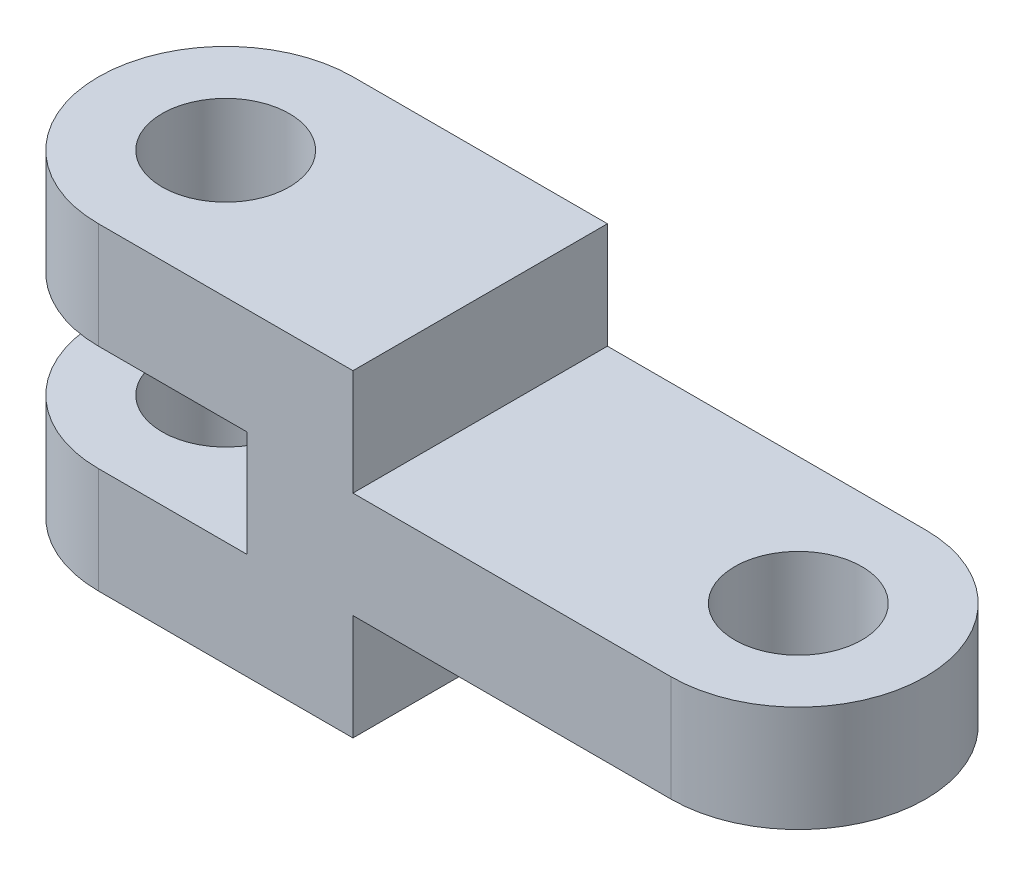
from build123d import *

# Parameters (mm, degrees)
BOSS_EXTRUDE1_DEPTH     = 60
BOSS_EXTRUDE2_DEPTH     = 25
BOSS_EXTRUDE3_DEPTH     = 25
BOSS_EXTRUDE4_DEPTH     = 25
CUT_EXTRUDE2_DEPTH      = 191.91883092
CUT_EXTRUDE2_DEPTH_BACK = 191.91883092
SKETCH6_R               = 15
CUT_EXTRUDE3_DEPTH      = 183.551362635
CUT_EXTRUDE3_DEPTH_BACK = 183.551362635
SKETCH7_R               = 15


with BuildPart() as part:
    # Sketch1 → Boss-Extrude1 (new body)
    with BuildSketch(Plane.XY):
        Polygon((0, 0), (60, 0), (60, -25), (135, -25), (135, -50), (60, -50), (60, -75), (0, -75), (0, -50), (35, -50), (35, -25), (0, -25), align=None)
    extrude(amount=BOSS_EXTRUDE1_DEPTH)

    # Sketch3 → Boss-Extrude2 (add)
    with BuildSketch(Plane(origin=(0, 0, 0), x_dir=(1, 0, 0), z_dir=(0, 1, 0))):
        with BuildLine():
            Line((0, 0), (0, -60))
            ThreePointArc((0, -60), (-30, -30), (0, 0))
        make_face()
    extrude(amount=-BOSS_EXTRUDE2_DEPTH)

    # Sketch4 → Boss-Extrude3 (add)
    with BuildSketch(Plane(origin=(0, -50, 0), x_dir=(1, 0, 0), z_dir=(0, 1, 0))):
        with BuildLine():
            Line((0, 0), (0, -60))
            ThreePointArc((0, -60), (-30, -30), (0, 0))
        make_face()
    extrude(amount=-BOSS_EXTRUDE3_DEPTH)

    # Sketch5 → Boss-Extrude4 (add)
    with BuildSketch(Plane(origin=(0, -25, 0), x_dir=(1, 0, 0), z_dir=(0, 1, 0))):
        with BuildLine():
            Line((135, 0), (135, -60))
            ThreePointArc((135, -60), (165, -30), (135, 0))
        make_face()
    extrude(amount=-BOSS_EXTRUDE4_DEPTH)

    # Sketch6 → Cut-Extrude2 (cut, two sides: drawn at the far end of the back side and taken through both)
    with BuildSketch(Plane(origin=(0, 0, 0), x_dir=(1, 0, 0), z_dir=(0, 1, 0)).offset(-CUT_EXTRUDE2_DEPTH_BACK)):
        with Locations(Location((0, -30, 0), (0, 0, 270))):
            Circle(SKETCH6_R)
    extrude(amount=CUT_EXTRUDE2_DEPTH + CUT_EXTRUDE2_DEPTH_BACK, mode=Mode.SUBTRACT)

    # Sketch7 → Cut-Extrude3 (cut, two sides: drawn at the far end of the back side and taken through both)
    with BuildSketch(Plane(origin=(0, -25, 0), x_dir=(1, 0, 0), z_dir=(0, 1, 0)).offset(-CUT_EXTRUDE3_DEPTH_BACK)):
        with Locations(Location((135, -30, 0), (0, 0, 180))):
            Circle(SKETCH7_R)
    extrude(amount=CUT_EXTRUDE3_DEPTH + CUT_EXTRUDE3_DEPTH_BACK, mode=Mode.SUBTRACT)


solid = part.part
